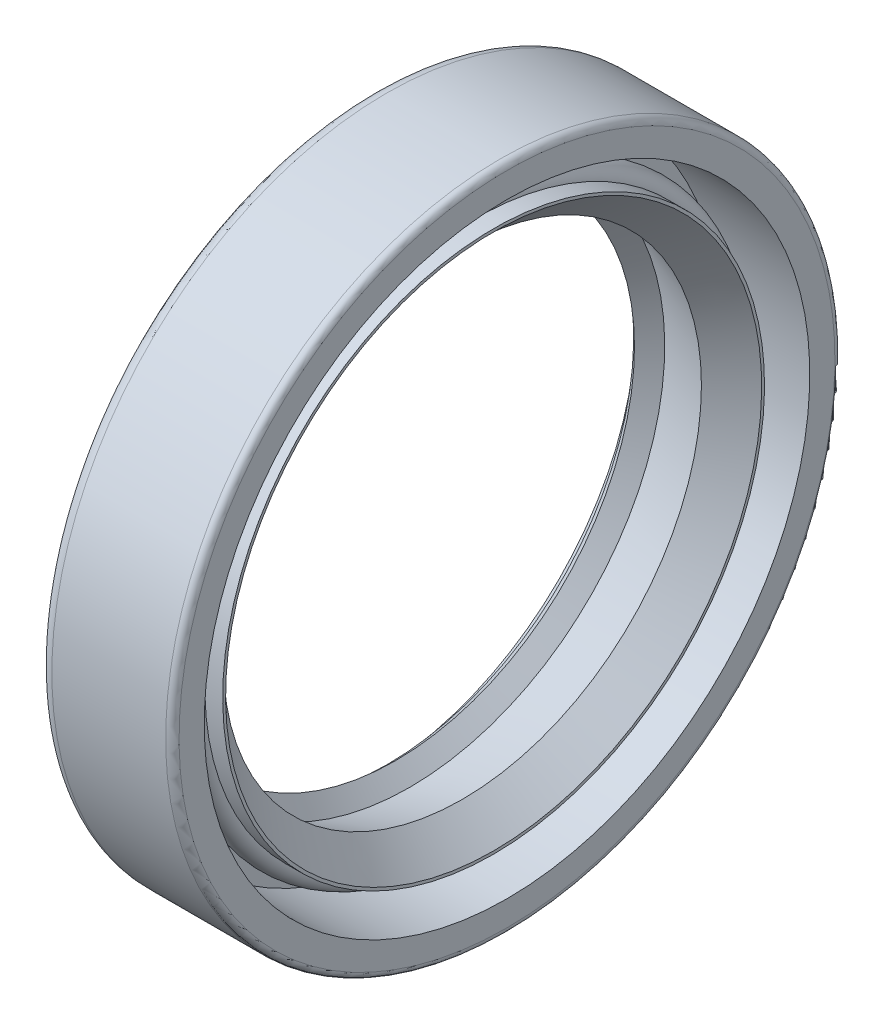
from build123d import *

# Parameters (mm, degrees)
SKETCH2_R = 0.7


with BuildPart() as part:
    # Sketch1 → Revolve1 (revolve)
    with BuildSketch(Plane.XY, mode=Mode.PRIVATE) as revolve1_sk:
        with BuildLine():
            Line((0, 15.833333333), (0.21875, 15.833333333))
            Line((0.21875, 15.833333333), (0.21875, 14.166666667))
            Line((0.21875, 14.166666667), (0, 14.166666667))
            Line((0, 14.166666667), (0, 13.75))
            Line((0, 13.75), (1.166666667, 13.333333333))
            Line((1.166666667, 13.333333333), (0.752484209, 12.871235372))
            Line((0.752484209, 12.871235372), (1.166666667, 12.5))
            Line((1.166666667, 12.5), (1.913590647, 13.333333333))
            Line((1.913590647, 13.333333333), (4.666666667, 12.5))
            Line((4.666666667, 12.5), (6.3, 14.016666667))
            Line((6.3, 14.016666667), (6.3, 14.166666667))
            Line((6.3, 14.166666667), (5.366666667, 14.166666667))
            ThreePointArc((5.366666667, 14.166666667), (4.666666667, 13.466666667), (3.966666667, 14.166666667))
            Line((3.966666667, 14.166666667), (2.683333333, 14.166666667))
            ThreePointArc((2.683333333, 14.166666667), (2.43584596, 14.269179293), (2.333333333, 14.516666667))
            Line((2.333333333, 14.516666667), (2.333333333, 15.833333333))
            Line((2.333333333, 15.833333333), (7, 15.833333333))
            Line((7, 15.833333333), (7, 17.15))
            ThreePointArc((7, 17.15), (6.897487373, 17.397487373), (6.65, 17.5))
            Line((6.65, 17.5), (0.7, 17.5))
            ThreePointArc((0.7, 17.5), (0.205025253, 17.294974747), (0, 16.8))
            Line((0, 16.8), (0, 15.833333333))
        make_face()
    revolve(revolve1_sk.sketch.rotate(Axis((7, 0, 0), (-1, 0, 0)), 180), axis=Axis((7, 0, 0), (-1, 0, 0)))


with BuildPart() as body_2:
    # Sketch2 → Revolve2 (revolve)
    with BuildSketch(Plane.XY, mode=Mode.PRIVATE) as revolve2_sk:
        with Locations((4.666666667, 14.166666667)):
            Circle(SKETCH2_R)
    revolve(revolve2_sk.sketch.rotate(Axis((0, 0, 0), (1, 0, 0)), 90), axis=Axis((0, 0, 0), (1, 0, 0)))


solid = Compound([part.part, body_2.part])
